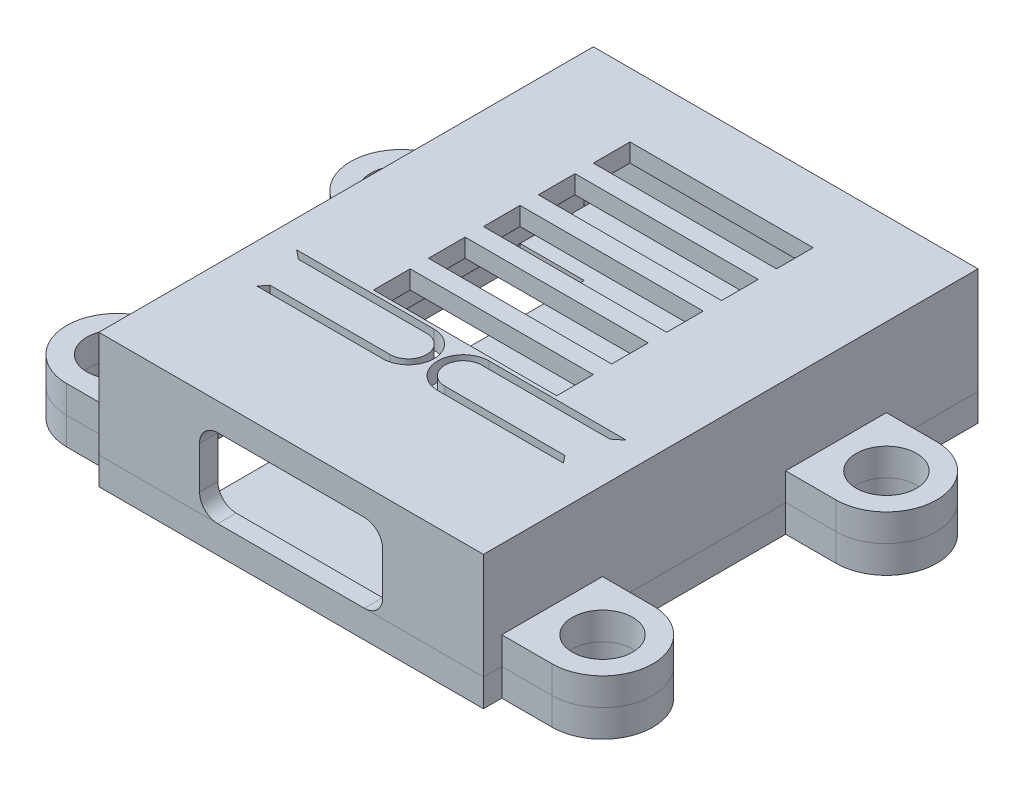
from build123d import *

# Parameters (mm, degrees)
SKETCH_1_W          = 21
SKETCH_1_H          = 27
SKETCH_1_W_2        = 19
SKETCH_1_H_2        = 25
EXTRUDE_1_DEPTH     = 6.3
CUT_EXTRUDE_1_REACH = 31.647
SKETCH_3_W          = 21
SKETCH_3_H          = 27
EXTRUDE_1_2_DEPTH   = 1
CUT_EXTRUDE_2_REACH = 20.595
SKETCH_4_W          = 3.5
SKETCH_4_H          = 21
EXTRUDE_2_DEPTH     = 3
CUT_EXTRUDE_3_REACH = 23.371
SKETCH_6_R          = 1.65
SKETCH_7_W          = 19
SKETCH_7_H          = 25
EXTRUDE_3_DEPTH     = 1
SKETCH_8_W          = 3.5
SKETCH_8_H          = 21
EXTRUDE_4_DEPTH     = 1.8
EXTRUDE_4_2_DEPTH   = 1.8
SKETCH_9_W          = 10
SKETCH_9_H          = 2
CUT_EXTRUDE_6_DEPTH = 1
CUT_EXTRUDE_7_DEPTH = 1


with BuildPart() as part:
    # 草图1 → Extrude 1 (new body)
    with BuildSketch(Plane.XZ):
        Rectangle(SKETCH_1_W, SKETCH_1_H)
        Rectangle(SKETCH_1_W_2, SKETCH_1_H_2, mode=Mode.SUBTRACT)
    extrude(amount=-EXTRUDE_1_DEPTH)

    # 草图2 → 切除-拉伸1 (cut, up to next)
    with BuildSketch(Plane.XY.offset(13.5), mode=Mode.PRIVATE) as cut_extrude_1_sk1:
        with BuildLine():
            Line((-4, 0.5), (4, 0.5))
            ThreePointArc((4, 0.5), (4.707106781, 0.792893219), (5, 1.5))
            Line((5, 1.5), (5, 3.8))
            ThreePointArc((5, 3.8), (4.707106781, 4.507106781), (4, 4.8))
            Line((4, 4.8), (-4, 4.8))
            ThreePointArc((-4, 4.8), (-4.707106781, 4.507106781), (-5, 3.8))
            Line((-5, 3.8), (-5, 1.5))
            ThreePointArc((-5, 1.5), (-4.707106781, 0.792893219), (-4, 0.5))
        make_face()
    cut_extrude_1_tool1 = extrude(cut_extrude_1_sk1.sketch, amount=-CUT_EXTRUDE_1_REACH, mode=Mode.PRIVATE) & part.part
    add(cut_extrude_1_tool1.solids().sort_by_distance((0, 2.65, 13.5))[0], mode=Mode.SUBTRACT)

    # 草图3 → Extrude 1 2 (add)
    with BuildSketch(Plane.XZ):
        Rectangle(SKETCH_3_W, SKETCH_3_H)
    extrude(amount=EXTRUDE_1_2_DEPTH)

    # 草图4 → 切除-拉伸2 (cut, up to next)
    with BuildSketch(Plane.XZ.offset(1), mode=Mode.PRIVATE) as cut_extrude_2_sk1:
        with Locations((-7.75, 2)):
            Rectangle(SKETCH_4_W, SKETCH_4_H)
    cut_extrude_2_tool1 = extrude(cut_extrude_2_sk1.sketch, amount=-CUT_EXTRUDE_2_REACH, mode=Mode.PRIVATE) & part.part
    # 草图4 → 切除-拉伸2 (cut, up to next)
    with BuildSketch(Plane.XZ.offset(1), mode=Mode.PRIVATE) as cut_extrude_2_sk2:
        with Locations((7.75, 2)):
            Rectangle(SKETCH_4_W, SKETCH_4_H)
    cut_extrude_2_tool2 = extrude(cut_extrude_2_sk2.sketch, amount=-CUT_EXTRUDE_2_REACH, mode=Mode.PRIVATE) & part.part
    add(cut_extrude_2_tool1.solids().sort_by_distance((-7.75, -1, 2))[0], mode=Mode.SUBTRACT)
    add(cut_extrude_2_tool2.solids().sort_by_distance((7.75, -1, 2))[0], mode=Mode.SUBTRACT)

    # 草图5 → 凸台-拉伸2 (add)
    with BuildSketch(Plane.XZ.offset(1)):
        with BuildLine():
            Line((-13.25, 12.5), (-10.5, 12.5))
            Line((-10.5, 12.5), (-10.5, 7))
            Line((-10.5, 7), (-13.25, 7))
            ThreePointArc((-13.25, 7), (-16, 9.75), (-13.25, 12.5))
        make_face()
        with BuildLine():
            Line((-10.5, -8.5), (-10.5, -3))
            Line((-10.5, -3), (-13.25, -3))
            ThreePointArc((-13.25, -3), (-16, -5.75), (-13.25, -8.5))
            Line((-13.25, -8.5), (-10.5, -8.5))
        make_face()
        with BuildLine():
            Line((13.25, -8.5), (10.5, -8.5))
            Line((10.5, -8.5), (10.5, -3))
            Line((10.5, -3), (13.25, -3))
            ThreePointArc((13.25, -3), (16, -5.75), (13.25, -8.5))
        make_face()
        with BuildLine():
            Line((10.5, 12.5), (10.5, 7))
            Line((10.5, 7), (13.25, 7))
            ThreePointArc((13.25, 7), (16, 9.75), (13.25, 12.5))
            Line((13.25, 12.5), (10.5, 12.5))
        make_face()
    extrude(amount=-EXTRUDE_2_DEPTH)

    # 草图6 → 切除-拉伸3 (cut, up to next)
    with BuildSketch(Plane(origin=(0, 2, 0), x_dir=(1, 0, 0), z_dir=(0, 1, 0)), mode=Mode.PRIVATE) as cut_extrude_3_sk1:
        with Locations(Location((-13.25, 5.75, 0), (0, 0, 270))):
            Circle(SKETCH_6_R)
    cut_extrude_3_tool1 = extrude(cut_extrude_3_sk1.sketch, amount=-CUT_EXTRUDE_3_REACH, mode=Mode.PRIVATE) & part.part
    # 草图6 → 切除-拉伸3 (cut, up to next)
    with BuildSketch(Plane(origin=(0, 2, 0), x_dir=(1, 0, 0), z_dir=(0, 1, 0)), mode=Mode.PRIVATE) as cut_extrude_3_sk2:
        with Locations(Location((-13.25, -9.75, 0), (0, 0, 270))):
            Circle(SKETCH_6_R)
    cut_extrude_3_tool2 = extrude(cut_extrude_3_sk2.sketch, amount=-CUT_EXTRUDE_3_REACH, mode=Mode.PRIVATE) & part.part
    # 草图6 → 切除-拉伸3 (cut, up to next)
    with BuildSketch(Plane(origin=(0, 2, 0), x_dir=(1, 0, 0), z_dir=(0, 1, 0)), mode=Mode.PRIVATE) as cut_extrude_3_sk3:
        with Locations(Location((13.25, -9.75, 0), (0, 0, 270))):
            Circle(SKETCH_6_R)
    cut_extrude_3_tool3 = extrude(cut_extrude_3_sk3.sketch, amount=-CUT_EXTRUDE_3_REACH, mode=Mode.PRIVATE) & part.part
    # 草图6 → 切除-拉伸3 (cut, up to next)
    with BuildSketch(Plane(origin=(0, 2, 0), x_dir=(1, 0, 0), z_dir=(0, 1, 0)), mode=Mode.PRIVATE) as cut_extrude_3_sk4:
        with Locations(Location((13.25, 5.75, 0), (0, 0, 270))):
            Circle(SKETCH_6_R)
    cut_extrude_3_tool4 = extrude(cut_extrude_3_sk4.sketch, amount=-CUT_EXTRUDE_3_REACH, mode=Mode.PRIVATE) & part.part
    add(cut_extrude_3_tool1.solids().sort_by_distance((-13.25, 2, -5.75))[0], mode=Mode.SUBTRACT)
    add(cut_extrude_3_tool2.solids().sort_by_distance((-13.25, 2, 9.75))[0], mode=Mode.SUBTRACT)
    add(cut_extrude_3_tool3.solids().sort_by_distance((13.25, 2, 9.75))[0], mode=Mode.SUBTRACT)
    add(cut_extrude_3_tool4.solids().sort_by_distance((13.25, 2, -5.75))[0], mode=Mode.SUBTRACT)

    # 草图7 → 凸台-拉伸3 (add)
    with BuildSketch(Plane(origin=(0, 6.3, 0), x_dir=(1, 0, 0), z_dir=(0, 1, 0))):
        Rectangle(SKETCH_7_W, SKETCH_7_H)
    extrude(amount=-EXTRUDE_3_DEPTH)

    # 草图9 → 切除-拉伸6 (cut)
    with BuildSketch(Plane(origin=(0, 6.3, 0), x_dir=(1, 0, 0), z_dir=(0, 1, 0))):
        with Locations((0, 9)):
            Rectangle(SKETCH_9_W, SKETCH_9_H)
        with Locations((0, 6)):
            Rectangle(SKETCH_9_W, SKETCH_9_H)
        with Locations((0, 3)):
            Rectangle(SKETCH_9_W, SKETCH_9_H)
        Rectangle(SKETCH_9_W, SKETCH_9_H)
        with Locations((0, -3)):
            Rectangle(SKETCH_9_W, SKETCH_9_H)
    extrude(amount=-CUT_EXTRUDE_6_DEPTH, mode=Mode.SUBTRACT)

    # 草图10 → 切除-拉伸7 (cut)
    with BuildSketch(Plane(origin=(0, 6.3, 0), x_dir=(1, 0, 0), z_dir=(0, 1, 0))):
        with BuildLine():
            Line((-1.5, -4.6), (-8.5, -4.6))
            Line((-8.5, -4.6), (-9, -4.2))
            Line((-9, -4.2), (-1.5, -4.2))
            ThreePointArc((-1.5, -4.2), (-0.1, -5.6), (-1.5, -7))
            Line((-1.5, -7), (-8.37, -7))
            Line((-8.37, -7), (-8.05, -6.6))
            Line((-8.05, -6.6), (-1.5, -6.6))
            ThreePointArc((-1.5, -6.6), (-0.5, -5.6), (-1.5, -4.6))
        make_face()
        with BuildLine():
            Line((8.05, -6.6), (8.37, -7))
            Line((8.37, -7), (1.5, -7))
            ThreePointArc((1.5, -7), (0.1, -5.6), (1.5, -4.2))
            Line((1.5, -4.2), (9, -4.2))
            Line((9, -4.2), (8.5, -4.6))
            Line((8.5, -4.6), (1.5, -4.6))
            ThreePointArc((1.5, -4.6), (0.5, -5.6), (1.5, -6.6))
            Line((1.5, -6.6), (8.05, -6.6))
        make_face()
    extrude(amount=-CUT_EXTRUDE_7_DEPTH, mode=Mode.SUBTRACT)


with BuildPart() as body_2:
    # 草图8 → 凸台-拉伸4 (new body)
    with BuildSketch(Plane.XZ.offset(-5.3)):
        with Locations((-7.75, 2)):
            Rectangle(SKETCH_8_W, SKETCH_8_H)
    extrude(amount=EXTRUDE_4_DEPTH)


with BuildPart() as body_3:
    # 草图8 → Extrude 4 2 (new body)
    with BuildSketch(Plane.XZ.offset(-5.3)):
        with Locations((7.75, 2)):
            Rectangle(SKETCH_8_W, SKETCH_8_H)
    extrude(amount=EXTRUDE_4_2_DEPTH)


with BuildPart() as body_4:
    # Split Bodies 1: the piece on the far side of the plane
    add(part.part)
    split(bisect_by=Plane(origin=(0, 0.5, 0), x_dir=(0, 0, -1), z_dir=(0, -1, 0)), keep=Keep.BOTTOM)


with BuildPart() as part_1:
    add(part.part)

    # Split Bodies 1
    split(bisect_by=Plane(origin=(0, 0.5, 0), x_dir=(0, 0, -1), z_dir=(0, -1, 0)), keep=Keep.TOP)


solid = Compound([body_2.part, body_3.part, body_4.part, part_1.part])
